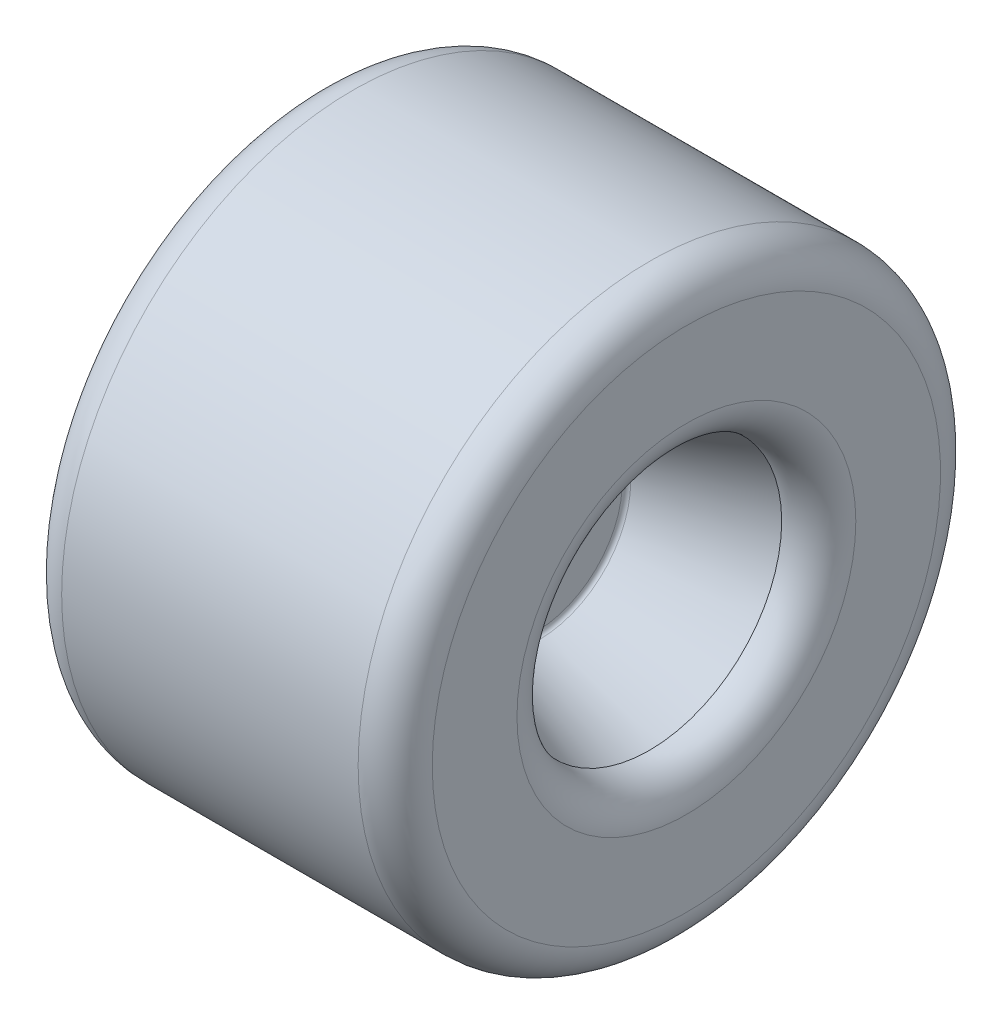
from build123d import *

# Parameters (mm, degrees)
CUT_EXTRUDE2_DEPTH      = 217.645770893
CUT_EXTRUDE2_DEPTH_BACK = 217.645770893
SKETCH3_R               = 21.59
CUT_EXTRUDE3_DEPTH      = 217.645770893
CUT_EXTRUDE3_DEPTH_BACK = 217.645770893
SKETCH4_R               = 5
FILLET1_R               = 2.54


with BuildPart() as part:
    # Sketch1 → Revolve2 (revolve)
    with BuildSketch(Plane.XY, mode=Mode.PRIVATE) as revolve2_sk:
        with BuildLine():
            Line((-71.12, 139.7), (71.12, 139.7))
            ThreePointArc((71.12, 139.7), (83.692358569, 134.492358569), (88.9, 121.92))
            Line((88.9, 121.92), (88.9, 81.28))
            ThreePointArc((88.9, 81.28), (83.692358569, 68.707641431), (71.12, 63.5))
            Line((71.12, 63.5), (16.51, 43.426119218))
            Line((16.51, 43.426119218), (16.51, 0))
            Line((16.51, 0), (3.796742982, 0))
            Line((3.796742982, 0), (3.796742982, 43.426119218))
            Line((3.796742982, 43.426119218), (-71.12, 63.5))
            ThreePointArc((-71.12, 63.5), (-83.692358569, 68.707641431), (-88.9, 81.28))
            Line((-88.9, 81.28), (-88.9, 121.92))
            ThreePointArc((-88.9, 121.92), (-83.692358569, 134.492358569), (-71.12, 139.7))
        make_face()
    revolve(revolve2_sk.sketch.rotate(Axis((3.796742982, 0, 0), (1, 0, 0)), 90), axis=Axis((3.796742982, 0, 0), (1, 0, 0)))

    # Sketch3 → Cut-Extrude2 (cut, two sides: drawn at the far end of the back side and taken through both)
    with BuildSketch(Plane(origin=(0, 0, 0), x_dir=(0, 0, -1), z_dir=(1, 0, 0)).offset(-CUT_EXTRUDE2_DEPTH_BACK)):
        Circle(SKETCH3_R)
    extrude(amount=CUT_EXTRUDE2_DEPTH + CUT_EXTRUDE2_DEPTH_BACK, mode=Mode.SUBTRACT)

    # Sketch4 → Cut-Extrude3 (cut, two sides: drawn at the far end of the back side and taken through both)
    with BuildSketch(Plane(origin=(0, 0, 0), x_dir=(0, 0, -1), z_dir=(1, 0, 0)).offset(-CUT_EXTRUDE3_DEPTH_BACK)):
        with Locations((31.75, 0)):
            Circle(SKETCH4_R)
        with Locations((-15.875, -27.49630657)):
            Circle(SKETCH4_R)
        with Locations((-15.875, 27.49630657)):
            Circle(SKETCH4_R)
    extrude(amount=CUT_EXTRUDE3_DEPTH + CUT_EXTRUDE3_DEPTH_BACK, mode=Mode.SUBTRACT)

    # Fillet1
    fillet1_edges = [part.edges().sort_by_distance(p)[0] for p in [
        (16.51, 0, -43.426119218),
        (3.796742982, 0, -43.426119218),
    ]]
    fillet(fillet1_edges, radius=FILLET1_R)


solid = part.part
